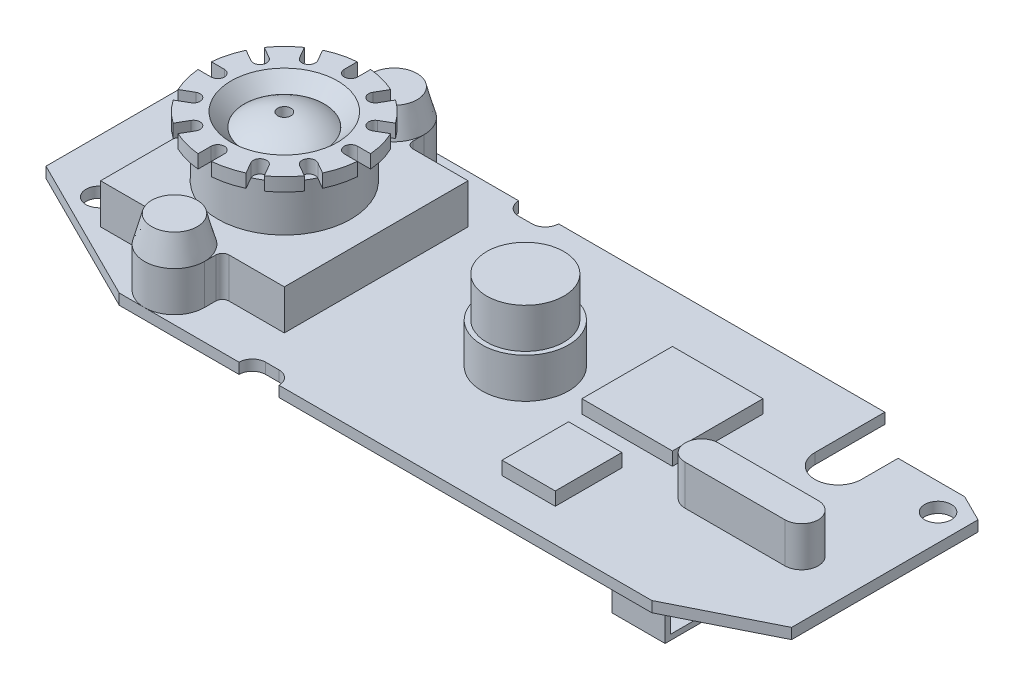
from build123d import *

# Parameters (mm, degrees)
EXTRUDE_1_DEPTH           = 0.4
SKETCH_3_R                = 3.25
EXTRUDE_2_DEPTH           = 3
SKETCH_4_R                = 2.9
EXTRUDE_3_DEPTH           = 3
SKETCH_5_W                = 6.8
SKETCH_5_H                = 6.8
EXTRUDE_4_DEPTH           = 1
CUT_EXTRUDE_2_DEPTH       = 1
SKETCH_9_W                = 5.887382388
SKETCH_9_H                = 25.847044632
CUT_EXTRUDE_5_DEPTH       = 1
CUT_EXTRUDE_3_DEPTH       = 1
SKETCH_8_W                = 15.56974784
SKETCH_8_H                = 6.161944412
CUT_EXTRUDE_4_DEPTH       = 1
SKETCH_10_W               = 13.8
SKETCH_10_H               = 13.8
EXTRUDE_5_DEPTH           = 3
EXTRUDE_6_DEPTH           = 3
FILLET_1_R                = 0.5
SKETCH_12_R               = 2.25
EXTRUDE_7_DEPTH           = 2
EXTRUDE_7_DRAFT           = 15
EXTRUDE_7_PROFILE_2_DEPTH = 2
EXTRUDE_7_PROFILE_2_DRAFT = 15
SKETCH_13_R               = 5
EXTRUDE_8_DEPTH           = 3.5
SKETCH_14_R               = 6
EXTRUDE_9_DEPTH           = 1
CUT_EXTRUDE_6_DEPTH       = 1
PATTERN_CIRCULAR_1_COUNT  = 12
SKETCH_17_W               = 4
SKETCH_17_H               = 5
EXTRUDE_10_DEPTH          = 1
EXTRUDE_11_DEPTH          = 3
SKETCH_19_R               = 3
CUT_EXTRUDE_7_DEPTH       = 2
CHAMFER_1_SIZE            = 1
SKETCH_21_R               = 0.5
CUT_EXTRUDE_8_DEPTH       = 2
SKETCH_22_W               = 4
SKETCH_22_H               = 6
EXTRUDE_12_DEPTH          = 3
SKETCH_23_W               = 5.201470472
SKETCH_23_H               = 2.2
CUT_EXTRUDE_9_DEPTH       = 3.5
SKETCH_25_W               = 1
SKETCH_25_H               = 3.8
F_2_0MM_1_AT_2_COUNT      = 2
F_2_0MM_1_AT_2_PITCH      = 53.150729064


with BuildPart() as part:
    # 草圖1 → 填料-伸長1 (new, symmetric)
    with BuildSketch(Plane(origin=(0, 0, 0), x_dir=(1, 0, 0), z_dir=(0, 1, 0))):
        Polygon((-20, -10.5), (20, -10.5), (31, -5), (31, 5), (20, 10.5), (-20, 10.5), (-31, 5), (-31, -5), align=None)
    extrude(amount=EXTRUDE_1_DEPTH, both=True)

    # 草圖3 → 填料-伸長2 (add)
    with BuildSketch(Plane(origin=(0, 0.4, 0), x_dir=(1, 0, 0), z_dir=(0, 1, 0))):
        with Locations(Location((0, 0, 0), (0, 0, 270))):
            Circle(SKETCH_3_R)
    extrude(amount=EXTRUDE_2_DEPTH)

    # 草圖4 → 填料-伸長3 (add)
    with BuildSketch(Plane(origin=(0, 3.4, 0), x_dir=(1, 0, 0), z_dir=(0, 1, 0))):
        with Locations(Location((0, 0, 0), (0, 0, 270))):
            Circle(SKETCH_4_R)
    extrude(amount=EXTRUDE_3_DEPTH)

    # 草圖5 → 填料-伸長4 (add)
    with BuildSketch(Plane(origin=(0, 0.4, 0), x_dir=(1, 0, 0), z_dir=(0, 1, 0))):
        with Locations((8.65, 2.4)):
            Rectangle(SKETCH_5_W, SKETCH_5_H)
    extrude(amount=EXTRUDE_4_DEPTH)

    # 草圖6 → 除料-伸長2 (cut)
    with BuildSketch(Plane(origin=(0, 0.4, 0), x_dir=(1, 0, 0), z_dir=(0, 1, 0))):
        with BuildLine():
            Line((-10, 11.5), (-9, 11.5))
            ThreePointArc((-9, 11.5), (-8, 10.5), (-9, 9.5))
            Line((-9, 9.5), (-10, 9.5))
            ThreePointArc((-10, 9.5), (-11, 10.5), (-10, 11.5))
        make_face()
    cut_extrude_2 = extrude(amount=-CUT_EXTRUDE_2_DEPTH, mode=Mode.SUBTRACT)

    # 鏡射1: 除料-伸長2 across plane
    add(cut_extrude_2.mirror(Plane.XY), mode=Mode.SUBTRACT)

    # 草圖9 → 除料-伸長5 (cut)
    with BuildSketch(Plane(origin=(0, 0.4, 0), x_dir=(1, 0, 0), z_dir=(0, 1, 0))):
        with Locations((29.943691194, -0.502581423)):
            Rectangle(SKETCH_9_W, SKETCH_9_H)
    extrude(amount=-CUT_EXTRUDE_5_DEPTH, mode=Mode.SUBTRACT)

    # 草圖7 → 除料-伸長3 (cut)
    with BuildSketch(Plane(origin=(0, 0.4, 0), x_dir=(1, 0, 0), z_dir=(0, 1, 0))):
        with BuildLine():
            Line((16.5, 5.25), (16.5, 14.28535585))
            ThreePointArc((16.5, 14.28535585), (18.25, 16.03535585), (20, 14.28535585))
            Line((20, 14.28535585), (20, 5.25))
            ThreePointArc((20, 5.25), (18.25, 3.5), (16.5, 5.25))
        make_face()
    extrude(amount=-CUT_EXTRUDE_3_DEPTH, mode=Mode.SUBTRACT)

    # 草圖8 → 除料-伸長4 (cut)
    with BuildSketch(Plane(origin=(0, 0.4, 0), x_dir=(1, 0, 0), z_dir=(0, 1, 0))):
        with Locations((26.91753911, 11.080972206)):
            Rectangle(SKETCH_8_W, SKETCH_8_H)
    extrude(amount=-CUT_EXTRUDE_4_DEPTH, mode=Mode.SUBTRACT)

    # 草圖10 → 填料-伸長5 (add)
    with BuildSketch(Plane(origin=(0, 0.4, 0), x_dir=(1, 0, 0), z_dir=(0, 1, 0))):
        with Locations((-18.1, 0)):
            Rectangle(SKETCH_10_W, SKETCH_10_H)
    extrude(amount=EXTRUDE_5_DEPTH)

    # 草圖11 → 填料-伸長6 (add)
    with BuildSketch(Plane(origin=(0, 3.4, 0), x_dir=(1, 0, 0), z_dir=(0, 1, 0))):
        with BuildLine():
            Line((-15.85, 8.25), (-15.85, -8.25))
            ThreePointArc((-15.85, -8.25), (-18.1, -10.5), (-20.35, -8.25))
            Line((-20.35, -8.25), (-20.35, 8.25))
            ThreePointArc((-20.35, 8.25), (-18.1, 10.5), (-15.85, 8.25))
        make_face()
    extrude(amount=-EXTRUDE_6_DEPTH)

    # 圓角1
    fillet_1_edges = [part.edges().sort_by_distance(p)[0] for p in [
        (-15.85, 1.9, 6.9),
        (-15.85, 1.9, -6.9),
        (-20.35, 1.9, 6.9),
        (-20.35, 1.9, -6.9),
    ]]
    fillet(fillet_1_edges, radius=FILLET_1_R)


with BuildPart() as extrude_7_tool:
    # 草圖12 → 填料-伸長7 (with draft: the straight prism first)
    with BuildSketch(Plane(origin=(0, 3.4, 0), x_dir=(1, 0, 0), z_dir=(0, 1, 0))):
        with Locations((-18.1, 8.25)):
            Circle(SKETCH_12_R)
    extrude(amount=EXTRUDE_7_DEPTH)
    # 填料-伸長7: the draft: its side faces are tilted about the plane it starts from
    extrude_7_sides = [extrude_7_tool.faces().sort_by_distance(p)[0] for p in [
        (-20.35, 4.4, -8.25),
    ]]
    draft(extrude_7_sides, Plane(origin=(0, 3.4, 0), x_dir=(1, 0, 0), z_dir=(0, 1, 0)), EXTRUDE_7_DRAFT)


with BuildPart() as part_1:
    add(part.part)

    # 填料-伸長7: add extrude_7_tool
    add(extrude_7_tool.part)


with BuildPart() as extrude_7_profile_2_tool:
    # 草圖12 → 填料-伸長7 profile 2 (with draft: the straight prism first)
    with BuildSketch(Plane(origin=(0, 3.4, 0), x_dir=(1, 0, 0), z_dir=(0, 1, 0))):
        with Locations((-18.1, -8.25)):
            Circle(SKETCH_12_R)
    extrude(amount=EXTRUDE_7_PROFILE_2_DEPTH)
    # 填料-伸長7 profile 2: the draft: its side faces are tilted about the plane it starts from
    extrude_7_profile_2_sides = [extrude_7_profile_2_tool.faces().sort_by_distance(p)[0] for p in [
        (-20.35, 4.4, 8.25),
    ]]
    draft(extrude_7_profile_2_sides, Plane(origin=(0, 3.4, 0), x_dir=(1, 0, 0), z_dir=(0, 1, 0)), EXTRUDE_7_PROFILE_2_DRAFT)


with BuildPart() as part_2:
    add(part_1.part)

    # 填料-伸長7 profile 2: add extrude_7_profile_2_tool
    add(extrude_7_profile_2_tool.part)

    # 草圖13 → 填料-伸長8 (add)
    with BuildSketch(Plane(origin=(0, 3.4, 0), x_dir=(1, 0, 0), z_dir=(0, 1, 0))):
        with Locations(Location((-18.1, 0, 0), (0, 0, 270))):
            Circle(SKETCH_13_R)
    extrude(amount=EXTRUDE_8_DEPTH)

    # 草圖14 → 填料-伸長9 (add)
    with BuildSketch(Plane(origin=(0, 6.9, 0), x_dir=(1, 0, 0), z_dir=(0, 1, 0))):
        with Locations(Location((-18.1, 0, 0), (0, 0, 270))):
            Circle(SKETCH_14_R)
    extrude(amount=EXTRUDE_9_DEPTH)

    # 草圖15 → 除料-伸長6 (cut)
    with BuildSketch(Plane(origin=(0, 7.9, 0), x_dir=(1, 0, 0), z_dir=(0, 1, 0))):
        with BuildLine():
            Line((-14.166987298, 5.812177826), (-15.166987298, 4.080127019))
            ThreePointArc((-15.166987298, 4.080127019), (-15.85, 3.897114317), (-16.033012702, 4.580127019))
            Line((-16.033012702, 4.580127019), (-15.033012702, 6.312177826))
            ThreePointArc((-15.033012702, 6.312177826), (-14.35, 6.495190528), (-14.166987298, 5.812177826))
        make_face()
    cut_extrude_6 = extrude(amount=-CUT_EXTRUDE_6_DEPTH, mode=Mode.SUBTRACT)

    # 環狀複製排列1: 除料-伸長6 ×12 about axis
    pattern_circular_1_axis = Axis((-18.1, 0, 0), (0, 1, 0))
    for i in range(1, PATTERN_CIRCULAR_1_COUNT):
        add(cut_extrude_6.rotate(pattern_circular_1_axis, i * 360 / PATTERN_CIRCULAR_1_COUNT), mode=Mode.SUBTRACT)

    # 草圖17 → 填料-伸長10 (add)
    with BuildSketch(Plane(origin=(0, 0.4, 0), x_dir=(1, 0, 0), z_dir=(0, 1, 0))):
        with Locations((8.25, -5.5)):
            Rectangle(SKETCH_17_W, SKETCH_17_H)
    extrude(amount=EXTRUDE_10_DEPTH)

    # 草圖18 → 填料-伸長11 (add)
    with BuildSketch(Plane(origin=(0, 0.4, 0), x_dir=(1, 0, 0), z_dir=(0, 1, 0))):
        with BuildLine():
            Line((15.25, -0.75), (22.75, -0.75))
            ThreePointArc((22.75, -0.75), (24, -2), (22.75, -3.25))
            Line((22.75, -3.25), (15.25, -3.25))
            ThreePointArc((15.25, -3.25), (14, -2), (15.25, -0.75))
        make_face()
    extrude(amount=EXTRUDE_11_DEPTH)

    # 草圖19 → 除料-伸長7 (cut)
    with BuildSketch(Plane(origin=(0, 7.9, 0), x_dir=(1, 0, 0), z_dir=(0, 1, 0))):
        with Locations(Location((-18.1, 0, 0), (0, 0, 270))):
            Circle(SKETCH_19_R)
    extrude(amount=-CUT_EXTRUDE_7_DEPTH, mode=Mode.SUBTRACT)

    # 導角1
    chamfer_1_edges = [part_2.edges().sort_by_distance(p)[0] for p in [
        (-18.1, 7.9, -3),
    ]]
    chamfer(chamfer_1_edges, length=CHAMFER_1_SIZE)

    # 草圖22 → 填料-伸長12 (add)
    with BuildSketch(Plane.XZ.offset(0.4)):
        with Locations((17.5, 6)):
            Rectangle(SKETCH_22_W, SKETCH_22_H)
    extrude(amount=EXTRUDE_12_DEPTH)

    # 草圖23 → 除料-伸長9 (cut)
    with BuildSketch(Plane(origin=(19.5, 0, 0), x_dir=(0, 0, -1), z_dir=(1, 0, 0))):
        with Locations((-6.000735236, -1.9)):
            Rectangle(SKETCH_23_W, SKETCH_23_H)
    extrude(amount=-CUT_EXTRUDE_9_DEPTH, mode=Mode.SUBTRACT)

    # 草圖25 → Ø2.0mm 定位孔1 (revolve, cut)
    with BuildSketch(Plane(origin=(-27, 0.4, 5), x_dir=(0, 0, 1), z_dir=(1, 0, 0))):
        with Locations((0.5, 1.9)):
            Rectangle(SKETCH_25_W, SKETCH_25_H)
    f_2_0mm_1 = revolve(axis=Axis((-27, 6.75, 5), (0, -1, 0)), mode=Mode.SUBTRACT)

    # Ø2.0mm 定位孔1 at 2: Ø2.0mm 定位孔1 ×2
    with Locations(*[Vector(0.9783497031189412, 0, -0.20695859104439143) * (i * F_2_0MM_1_AT_2_PITCH) for i in range(1, F_2_0MM_1_AT_2_COUNT)]):
        add(f_2_0mm_1, mode=Mode.SUBTRACT)


with BuildPart() as body_2:
    # 草圖20 → 旋轉1 (revolve)
    with BuildSketch(Plane.XY):
        with BuildLine():
            Line((-15.1, 6.9), (-18.1, 6.9))
            Line((-18.1, 6.9), (-18.1, 7.808388069))
            Line((-18.1, 7.808388069), (-18.1, 7.9))
            ThreePointArc((-18.1, 7.9), (-16.51886117, 7.64341649), (-15.1, 6.9))
        make_face()
    revolve(axis=Axis((-18.1, 5.9, 0), (0, 1, 0)))

    # 草圖21 → 除料-伸長8 (cut)
    with BuildSketch(Plane(origin=(0, 7.9, 0), x_dir=(1, 0, 0), z_dir=(0, 1, 0))):
        with Locations((-18.1, 0)):
            Circle(SKETCH_21_R)
    extrude(amount=-CUT_EXTRUDE_8_DEPTH, mode=Mode.SUBTRACT)


solid = Compound([part_2.part, body_2.part])
